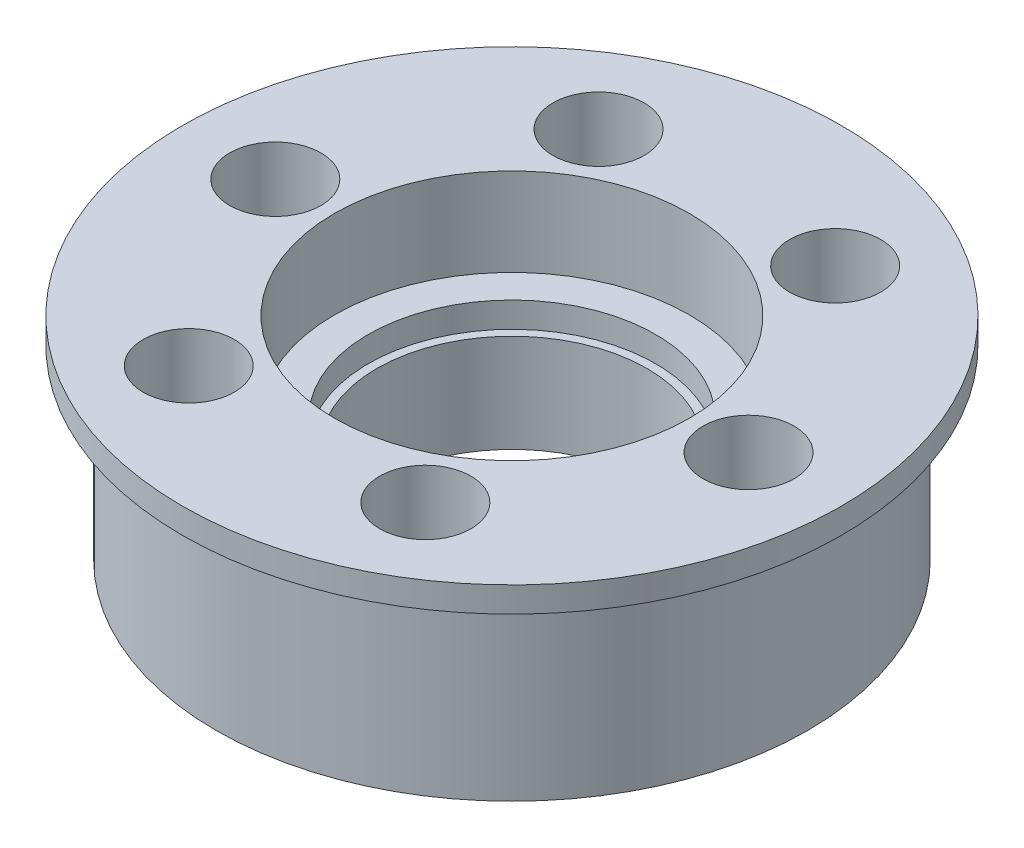
from build123d import *

# Parameters (mm, degrees)
SKETCH1_R           = 17.5
BOSS_EXTRUDE1_DEPTH = 11
SKETCH2_R           = 19.5
BOSS_EXTRUDE2_DEPTH = 1.5
SKETCH3_R           = 10.5
CUT_EXTRUDE1_DEPTH  = 5.2
SKETCH4_R           = 8.5
CUT_EXTRUDE2_DEPTH  = 1.5
CUT_EXTRUDE4_REACH  = 32.278
SKETCH7_R           = 8
SKETCH9_R           = 2.7
CUT_EXTRUDE5_DEPTH  = 6
SKETCH10_R          = 2.7
CUT_EXTRUDE6_DEPTH  = 6.5


with BuildPart() as part:
    # Sketch1 → Boss-Extrude1 (new body)
    with BuildSketch(Plane(origin=(0, 0, 0), x_dir=(1, 0, 0), z_dir=(0, 1, 0))):
        with Locations(Location((0, 0, 0), (0, 0, 270))):
            Circle(SKETCH1_R)
    extrude(amount=BOSS_EXTRUDE1_DEPTH)

    # Sketch2 → Boss-Extrude2 (add)
    with BuildSketch(Plane(origin=(0, 11, 0), x_dir=(1, 0, 0), z_dir=(0, 1, 0))):
        with Locations(Location((0, 0, 0), (0, 0, 270))):
            Circle(SKETCH2_R)
    extrude(amount=BOSS_EXTRUDE2_DEPTH)

    # Sketch3 → Cut-Extrude1 (cut)
    with BuildSketch(Plane(origin=(0, 12.5, 0), x_dir=(1, 0, 0), z_dir=(0, 1, 0))):
        with Locations(Location((0, 0, 0), (0, 0, 270))):
            Circle(SKETCH3_R)
    extrude(amount=-CUT_EXTRUDE1_DEPTH, mode=Mode.SUBTRACT)

    # Sketch4 → Cut-Extrude2 (cut)
    with BuildSketch(Plane(origin=(0, 7.3, 0), x_dir=(1, 0, 0), z_dir=(0, 1, 0))):
        with Locations(Location((0, 0, 0), (0, 0, 270))):
            Circle(SKETCH4_R)
    extrude(amount=-CUT_EXTRUDE2_DEPTH, mode=Mode.SUBTRACT)

    # Sketch7 → Cut-Extrude4 (cut, up to next)
    with BuildSketch(Plane.XZ, mode=Mode.PRIVATE) as cut_extrude4_sk1:
        with Locations(Location((0, 0, 0), (0, 0, 270))):
            Circle(SKETCH7_R)
    cut_extrude4_tool1 = extrude(cut_extrude4_sk1.sketch, amount=-CUT_EXTRUDE4_REACH, mode=Mode.PRIVATE) & part.part
    add(cut_extrude4_tool1.solids().sort_by_distance((0, 0, 0))[0], mode=Mode.SUBTRACT)

    # Sketch9 → Cut-Extrude5 (cut)
    with BuildSketch(Plane.XZ):
        with Locations(Location((0, 12.75, 0), (0, 0, 270))):
            Circle(SKETCH9_R)
        with Locations(Location((11.041823898, 6.375, 0), (0, 0, 270))):
            Circle(SKETCH9_R)
        with Locations(Location((11.041823898, -6.375, 0), (0, 0, 270))):
            Circle(SKETCH9_R)
        with Locations(Location((0, -12.75, 0), (0, 0, 270))):
            Circle(SKETCH9_R)
        with Locations(Location((-11.041823898, -6.375, 0), (0, 0, 270))):
            Circle(SKETCH9_R)
        with Locations(Location((-11.041823898, 6.375, 0), (0, 0, 270))):
            Circle(SKETCH9_R)
    extrude(amount=-CUT_EXTRUDE5_DEPTH, mode=Mode.SUBTRACT)

    # Sketch10 → Cut-Extrude6 (cut)
    with BuildSketch(Plane(origin=(0, 12.5, 0), x_dir=(1, 0, 0), z_dir=(0, 1, 0))):
        with Locations(Location((14, 0, 0), (0, 0, 270))):
            Circle(SKETCH10_R)
        with Locations(Location((7, -12.124355653, 0), (0, 0, 270))):
            Circle(SKETCH10_R)
        with Locations(Location((-7, -12.124355653, 0), (0, 0, 270))):
            Circle(SKETCH10_R)
        with Locations(Location((-14, 0, 0), (0, 0, 270))):
            Circle(SKETCH10_R)
        with Locations(Location((-7, 12.124355653, 0), (0, 0, 270))):
            Circle(SKETCH10_R)
        with Locations(Location((7, 12.124355653, 0), (0, 0, 270))):
            Circle(SKETCH10_R)
    extrude(amount=-CUT_EXTRUDE6_DEPTH, mode=Mode.SUBTRACT)


solid = part.part
